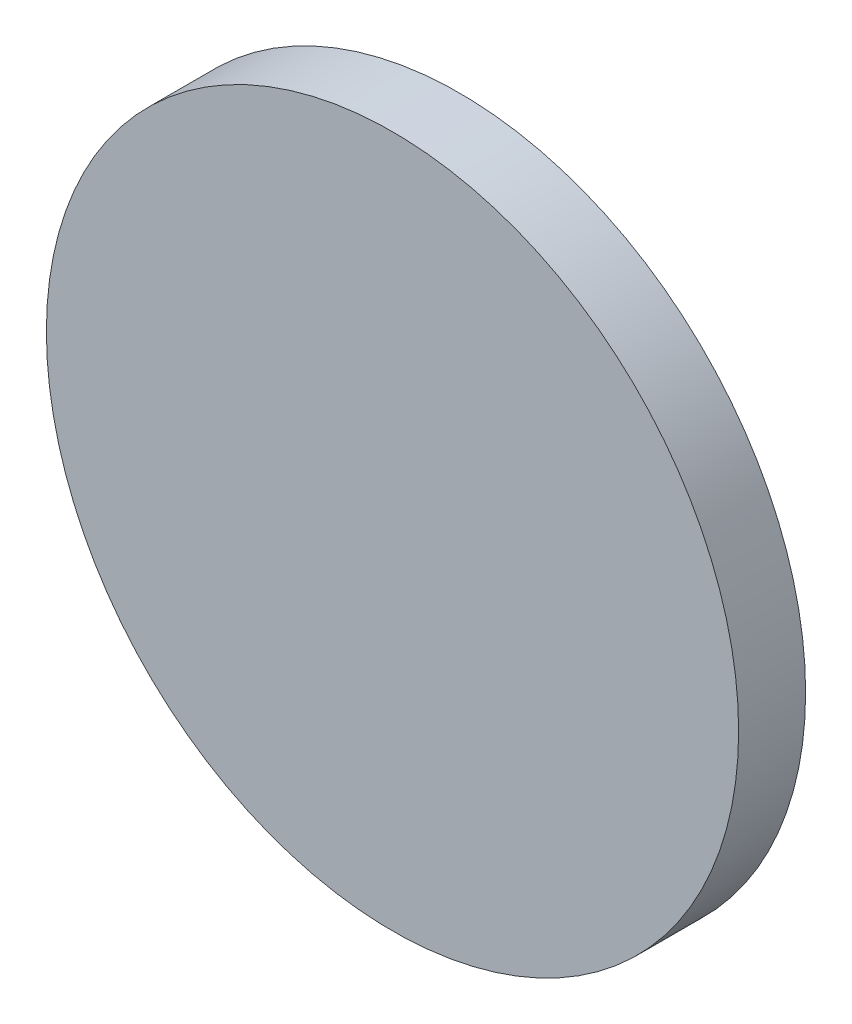
from build123d import *

# Parameters (mm, degrees)
SKETCH1_R           = 16.4084
BOSS_EXTRUDE1_DEPTH = 3.175


with BuildPart() as part:
    # Sketch1 → Boss-Extrude1 (new body)
    with BuildSketch(Plane.XY):
        Circle(SKETCH1_R)
    extrude(amount=BOSS_EXTRUDE1_DEPTH)


solid = part.part
